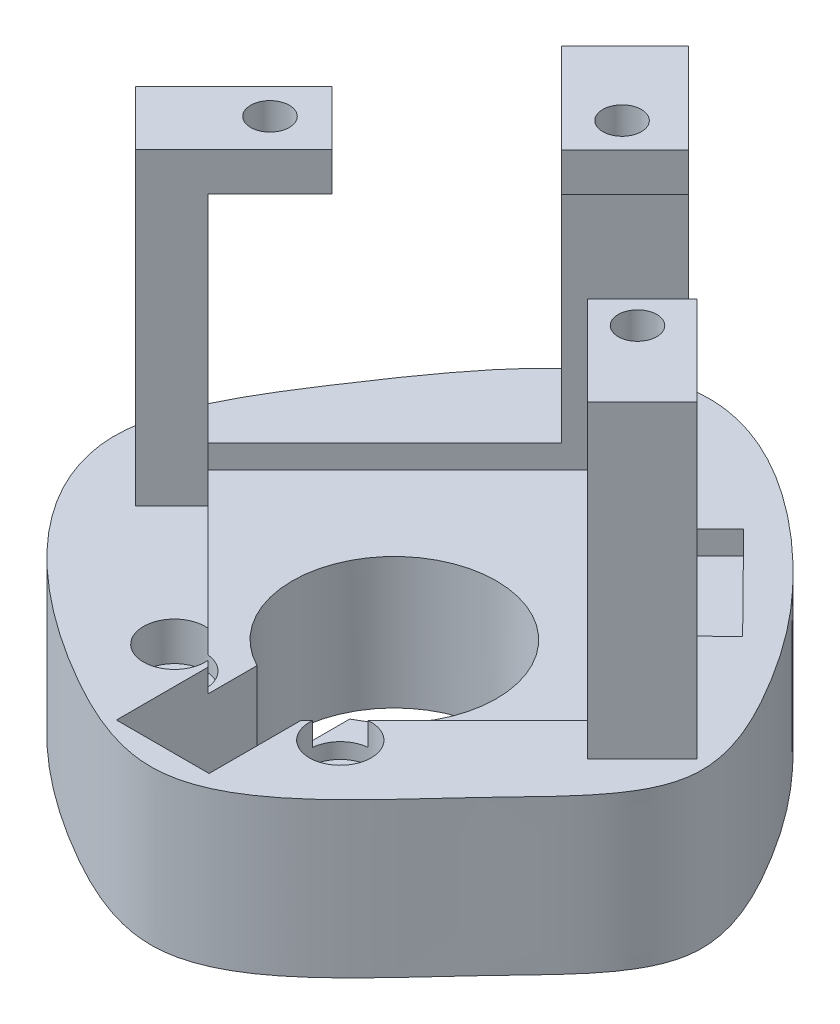
from build123d import *

# Parameters (mm, degrees)
BOSS_EXTRUDE1_DEPTH      = 10
BOSS_EXTRUDE1_DEPTH_BACK = 10
SKETCH2_R                = 60
SKETCH7_R                = 4
CUT_EXTRUDE2_DEPTH       = 5
CUT_EXTRUDE4_DEPTH       = 3
CUT_EXTRUDE5_DEPTH       = 3
BOSS_EXTRUDE2_DEPTH      = 35
BOSS_EXTRUDE3_DEPTH      = 5
SKETCH13_R               = 2.5
CUT_EXTRUDE7_DEPTH       = 5
SKETCH15_R               = 2.5
CUT_EXTRUDE8_DEPTH       = 5
SKETCH14_R               = 2.5
CUT_EXTRUDE9_DEPTH       = 5
SKETCH16_R               = 60
CUT_EXTRUDE10_DEPTH      = 38
SKETCH4_R                = 13.225
CUT_EXTRUDE12_DEPTH      = 42
SKETCH19_W               = 12
SKETCH19_H               = 20
CUT_EXTRUDE13_DEPTH      = 17


with BuildPart() as part:
    # Sketch2 → Boss-Extrude1 (new, two sides: drawn at the far end of the back side and taken through both)
    with BuildSketch(Plane(origin=(0, 0, 0), x_dir=(1, 0, 0), z_dir=(0, 1, 0)).offset(-BOSS_EXTRUDE1_DEPTH_BACK)):
        Circle(SKETCH2_R)
    extrude(amount=BOSS_EXTRUDE1_DEPTH + BOSS_EXTRUDE1_DEPTH_BACK)

    # Sketch7 → Cut-Extrude2 (cut)
    with BuildSketch(Plane(origin=(0, 10, 0), x_dir=(1, 0, 0), z_dir=(0, 1, 0))):
        with Locations((-10.75, -7.75)):
            Circle(SKETCH7_R)
    cut_extrude2 = extrude(amount=-CUT_EXTRUDE2_DEPTH, mode=Mode.SUBTRACT)

    # Mirror1: Cut-Extrude2 across plane
    add(cut_extrude2.mirror(Plane(origin=(0, 0, 0), x_dir=(0, 0, 1), z_dir=(1, 0, 0))), mode=Mode.SUBTRACT)

    # Sketch9 → Cut-Extrude4 (cut)
    with BuildSketch(Plane(origin=(0, 10, 0), x_dir=(1, 0, 0), z_dir=(0, 1, 0))):
        Polygon((-31.112706744, 17), (-8.372e-06, 48.112698372), (31.11269, 17), (-8.372e-06, -14.112698372), align=None)
    extrude(amount=-CUT_EXTRUDE4_DEPTH, mode=Mode.SUBTRACT)

    # Sketch6 → Cut-Extrude5 (cut)
    with BuildSketch(Plane(origin=(0, 10, 0), x_dir=(1, 0, 0), z_dir=(0, 1, 0))):
        Polygon((-5.977874391, 23.042765738), (5.977874391, 10.957234262), (25.17254203, 29.945776443), (13.216793249, 42.03130792), align=None)
    extrude(amount=-CUT_EXTRUDE5_DEPTH, mode=Mode.SUBTRACT)

    # Sketch11 → Boss-Extrude2 (add)
    with BuildSketch(Plane(origin=(0, 10, 0), x_dir=(1, 0, 0), z_dir=(0, 1, 0))):
        Polygon((-8.372e-06, 48.112698372), (-8.240017503, 39.872689242), (-12.799306685, 44.431978425), (-4.559297555, 52.671987555), align=None)
        Polygon((-31.112706744, 17), (-24.041638933, 9.928932188), (-28.755220541, 5.21535058), (-35.826288353, 12.286418392), align=None)
        Polygon((31.644591703, 17.531901703), (24.573523891, 10.460833891), (28.864455193, 6.169902588), (35.935523005, 13.2409704), align=None)
    extrude(amount=BOSS_EXTRUDE2_DEPTH)

    # Sketch12 → Boss-Extrude3 (add)
    with BuildSketch(Plane(origin=(0, 45, 0), x_dir=(1, 0, 0), z_dir=(0, 1, 0))):
        Polygon((-4.559297555, 52.671987555), (-12.799306685, 44.431978425), (-1.132044796, 32.764716535), (7.107964335, 41.004725665), align=None)
        Polygon((-35.826288353, 12.286418392), (-28.755220541, 5.21535058), (-16.027298479, 17.943272641), (-23.098366291, 25.014340453), align=None)
        Polygon((35.935523005, 13.2409704), (28.864455193, 6.169902588), (17.266701717, 17.767656064), (24.337769529, 24.838723876), align=None)
    extrude(amount=BOSS_EXTRUDE3_DEPTH)

    # Sketch13 → Cut-Extrude7 (cut)
    with BuildSketch(Plane(origin=(0, 50, 0), x_dir=(1, 0, 0), z_dir=(0, 1, 0))):
        with Locations((-0.5, 40)):
            Circle(SKETCH13_R)
    extrude(amount=-CUT_EXTRUDE7_DEPTH, mode=Mode.SUBTRACT)

    # Sketch15 → Cut-Extrude8 (cut)
    with BuildSketch(Plane(origin=(0, 50, 0), x_dir=(1, 0, 0), z_dir=(0, 1, 0))):
        with Locations((-23.777002133, 17.668993601)):
            Circle(SKETCH15_R)
    extrude(amount=-CUT_EXTRUDE8_DEPTH, mode=Mode.SUBTRACT)

    # Sketch14 → Cut-Extrude9 (cut)
    with BuildSketch(Plane(origin=(0, 50, 0), x_dir=(1, 0, 0), z_dir=(0, 1, 0))):
        with Locations((23.5, 18)):
            Circle(SKETCH14_R)
    extrude(amount=-CUT_EXTRUDE9_DEPTH, mode=Mode.SUBTRACT)

    # Sketch16 → Cut-Extrude10 (cut)
    with BuildSketch(Plane(origin=(0, 10, 0), x_dir=(1, 0, 0), z_dir=(0, 1, 0))):
        Circle(SKETCH16_R)
        with BuildLine():
            add(Edge.make_bspline(
                [(-4.79445414, 54.411479542), (3.711953261, 55.123778385), (20.176812176, 43.163893552), (32.095851639, 27.739664068), (41.103501035, 9.384731909), (23.441378071, -7.012281145), (7.387216057, -27.669539214), (-20.675561177, -15.265601832), (-45.215914175, 6.863059518), (-27.534475147, 35.312307502), (-14.416385352, 53.60577037), (-4.79445414, 54.411479542)],
                knots=[0, 0, 0, 0, 0.129983166, 0.216069769, 0.283536175, 0.368923683, 0.507401419, 0.580069943, 0.753753629, 0.852970941, 1, 1, 1, 1], degree=3))
        make_face(mode=Mode.SUBTRACT)
    extrude(amount=-CUT_EXTRUDE10_DEPTH, mode=Mode.SUBTRACT)

    # Sketch4 → Cut-Extrude12 (cut)
    with BuildSketch(Plane(origin=(0, 10, 0), x_dir=(1, 0, 0), z_dir=(0, 1, 0))):
        with Locations((0, 10)):
            Circle(SKETCH4_R)
    extrude(amount=-CUT_EXTRUDE12_DEPTH, mode=Mode.SUBTRACT)

    # Sketch19 → Cut-Extrude13 (cut)
    with BuildSketch(Plane(origin=(0, 10, 0), x_dir=(1, 0, 0), z_dir=(0, 1, 0))):
        with Locations((0, -10)):
            Rectangle(SKETCH19_W, SKETCH19_H)
    extrude(amount=-CUT_EXTRUDE13_DEPTH, mode=Mode.SUBTRACT)


solid = part.part
